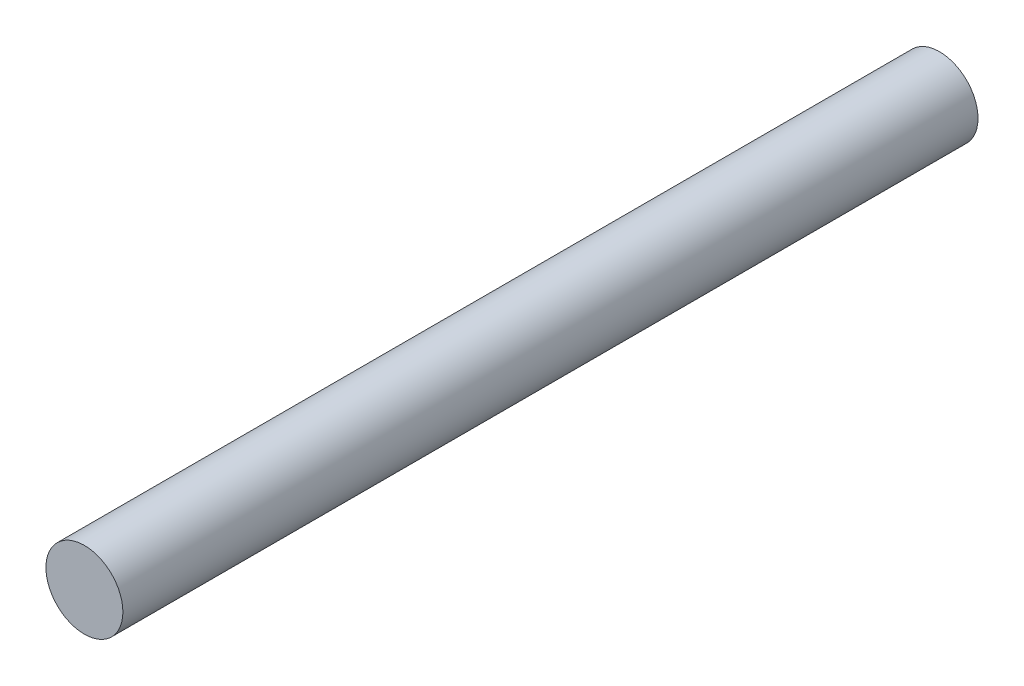
from build123d import *

# Parameters (mm, degrees)
ESBO_O1_R                = 2.7
RESSALTO_EXTRUS_O1_DEPTH = 60


with BuildPart() as part:
    # Esboço1 → Ressalto-extrusão1 (new body)
    with BuildSketch(Plane.XY):
        Circle(ESBO_O1_R)
    extrude(amount=RESSALTO_EXTRUS_O1_DEPTH)


solid = part.part
